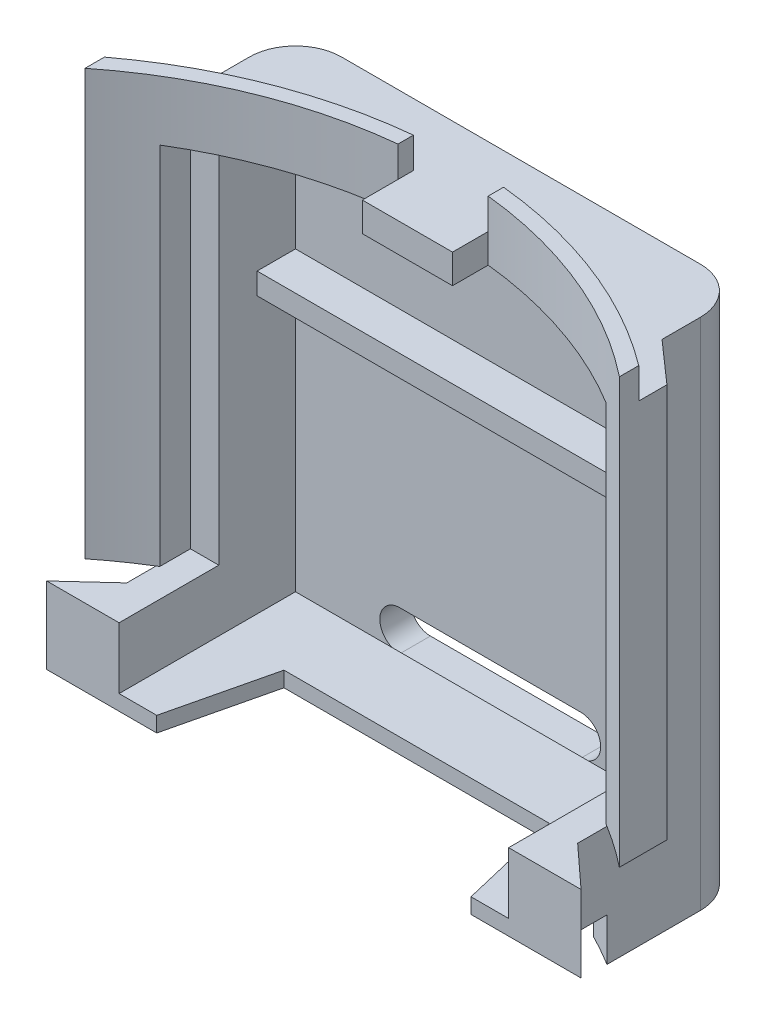
from build123d import *

# Parameters (mm, degrees)
EXTRUDE_1_DEPTH     = 17.75
CUT_EXTRUDE_1_DEPTH = 1
SKETCH_3_W          = 2.94
SKETCH_3_H          = 1
CUT_EXTRUDE_2_DEPTH = 21.522587556
CUT_EXTRUDE_3_DEPTH = 3.9
SKETCH_5_W          = 12.7
SKETCH_5_H          = 2.983573368
CUT_EXTRUDE_4_DEPTH = 1.4
SKETCH_6_W          = 12.7
SKETCH_6_H          = 2.983573368
CUT_EXTRUDE_5_DEPTH = 13.9
SKETCH_7_W          = 14.55
SKETCH_7_H          = 11.9
CUT_EXTRUDE_6_DEPTH = 21.079257954
EXTRUDE_2_DEPTH     = 0.5
EXTRUDE_3_DEPTH     = 0.5
EXTRUDE_4_DEPTH     = 2
CUT_EXTRUDE_7_DEPTH = 1
SKETCH_12_W         = 12.7
SKETCH_12_H         = 0.7
EXTRUDE_5_DEPTH     = 1.25
FILLET_1_R          = 1.5
EXTRUDE_START       = -0.95
EXTRUDE_6_DEPTH     = 0.95


with BuildPart() as part:
    # Эскиз1 → Бобышка-Вытянуть1 (new body)
    with BuildSketch(Plane(origin=(0, 0, 0), x_dir=(1, 0, 0), z_dir=(0, 1, 0))):
        with BuildLine():
            Line((-7.35, 2.75), (-7.35, 5.5))
            Line((-7.35, 5.5), (7.35, 5.5))
            Line((7.35, 5.5), (7.35, 2.75))
            Line((7.35, 2.75), (8.71, 1.55))
            Line((8.71, 1.55), (8.71, 0))
            ThreePointArc((8.71, 0), (0, 3.039347647), (-8.71, 0))
            Line((-8.71, 0), (-8.71, 1.55))
            Line((-8.71, 1.55), (-7.35, 2.75))
        make_face()
    extrude(amount=EXTRUDE_1_DEPTH)

    # Эскиз2 → Вырез-Вытянуть1 (cut)
    with BuildSketch(Plane(origin=(0, 17.75, 0), x_dir=(1, 0, 0), z_dir=(0, 1, 0))):
        with BuildLine():
            Line((8.71, 0.631840908), (8.71, 1.55))
            Line((8.71, 1.55), (7.35, 2.75))
            Line((7.35, 2.75), (7.35, 5.5))
            Line((7.35, 5.5), (-7.35, 5.5))
            Line((-7.35, 5.5), (-7.35, 2.75))
            Line((-7.35, 2.75), (-8.71, 1.55))
            Line((-8.71, 1.55), (-8.71, 0.631840908))
            ThreePointArc((-8.71, 0.631840908), (0, 3.539347647), (8.71, 0.631840908))
        make_face()
    extrude(amount=-CUT_EXTRUDE_1_DEPTH, mode=Mode.SUBTRACT)

    # Эскиз3 → Вырез-Вытянуть2 (cut, through all)
    with BuildSketch(Plane(origin=(0, 0, -5.5), x_dir=(-1, 0, 0), z_dir=(0, 0, -1))):
        with Locations((0, 17.25)):
            Rectangle(SKETCH_3_W, SKETCH_3_H)
    extrude(amount=-CUT_EXTRUDE_2_DEPTH, mode=Mode.SUBTRACT)

    # Эскиз4 → Вырез-Вытянуть3 (cut)
    with BuildSketch(Plane.XZ):
        with BuildLine():
            Line((-7.35, -2.75), (-7.35, -0.954778819))
            ThreePointArc((-7.35, -0.954778819), (-8.044178059, -0.497584831), (-8.71, 0))
            Line((-8.71, 0), (-8.71, -1.55))
            Line((-8.71, -1.55), (-7.35, -2.75))
        make_face()
        with BuildLine():
            Line((7.35, -2.75), (7.35, -0.954778819))
            ThreePointArc((7.35, -0.954778819), (8.044178059, -0.497584831), (8.71, 0))
            Line((8.71, 0), (8.71, -1.55))
            Line((8.71, -1.55), (7.35, -2.75))
        make_face()
    extrude(amount=-CUT_EXTRUDE_3_DEPTH, mode=Mode.SUBTRACT)

    # Эскиз5 → Вырез-Вытянуть4 (cut)
    with BuildSketch(Plane.XZ):
        with Locations((0, -3.008213316)):
            Rectangle(SKETCH_5_W, SKETCH_5_H)
    extrude(amount=-CUT_EXTRUDE_4_DEPTH, mode=Mode.SUBTRACT)

    # Эскиз6 → Вырез-Вытянуть5 (cut)
    with BuildSketch(Plane(origin=(0, 1.9, 0), x_dir=(-1, 0, 0), z_dir=(0, -1, 0))):
        with Locations((0, 3.008213316)):
            Rectangle(SKETCH_6_W, SKETCH_6_H)
    extrude(amount=-CUT_EXTRUDE_5_DEPTH, mode=Mode.SUBTRACT)

    # Эскиз7 → Вырез-Вытянуть6 (cut, through all)
    with BuildSketch(Plane(origin=(0, 0, -2), x_dir=(-1, 0, 0), z_dir=(0, 0, -1))):
        with Locations((0, 9.85)):
            Rectangle(SKETCH_7_W, SKETCH_7_H)
    extrude(amount=-CUT_EXTRUDE_6_DEPTH, mode=Mode.SUBTRACT)

    # Эскиз8 → Бобышка-Вытянуть2 (add)
    with BuildSketch(Plane.XZ.offset(-1.4)):
        with BuildLine():
            Line((-7.35, 0), (-4.825, 0))
            Line((-4.825, 0), (-4.325, -2.1))
            Line((-4.325, -2.1), (4.325, -2.1))
            Line((4.325, -2.1), (4.825, 0))
            Line((4.825, 0), (7.35, 0))
            Line((7.35, 0), (7.35, -0.954778819))
            ThreePointArc((7.35, -0.954778819), (0, -3.039347647), (-7.35, -0.954778819))
            Line((-7.35, -0.954778819), (-7.35, 0))
        make_face()
    extrude(amount=-EXTRUDE_2_DEPTH)

    # Эскиз9 → Бобышка-Вытянуть3 (add)
    with BuildSketch(Plane.XZ.offset(-1.4)):
        Polygon((-4.825, 0), (-5.122619048, 1.25), (-8.71, 1.25), (-7.35, 0), align=None)
        Polygon((4.825, 0), (5.122619048, 1.25), (8.71, 1.25), (7.35, 0), align=None)
    extrude(amount=-EXTRUDE_3_DEPTH)

    # Эскиз10 → Бобышка-Вытянуть4 (add)
    with BuildSketch(Plane(origin=(0, 1.9, 0), x_dir=(1, 0, 0), z_dir=(0, 1, 0))):
        with BuildLine():
            Line((-7.35, 0), (-8.71, -1.25))
            Line((-8.71, -1.25), (-6.35, -1.25))
            Line((-6.35, -1.25), (-6.35, 1.516426632))
            ThreePointArc((-6.35, 1.516426632), (-6.855753939, 1.24584747), (-7.35, 0.954778819))
            Line((-7.35, 0.954778819), (-7.35, 0))
        make_face()
        with BuildLine():
            Line((7.35, 0), (7.35, 0.954778819))
            ThreePointArc((7.35, 0.954778819), (6.855753939, 1.24584747), (6.35, 1.516426632))
            Line((6.35, 1.516426632), (6.35, -1.25))
            Line((6.35, -1.25), (8.71, -1.25))
            Line((8.71, -1.25), (7.35, 0))
        make_face()
    extrude(amount=EXTRUDE_4_DEPTH)

    # Эскиз11 → Вырез-Вытянуть7 (cut)
    with BuildSketch(Plane(origin=(0, 0, -5.5), x_dir=(-1, 0, 0), z_dir=(0, 0, -1))):
        with BuildLine():
            Line((-2.95, 3.15), (2.95, 3.15))
            ThreePointArc((2.95, 3.15), (3.6, 2.5), (2.95, 1.85))
            Line((2.95, 1.85), (-2.95, 1.85))
            ThreePointArc((-2.95, 1.85), (-3.6, 2.5), (-2.95, 3.15))
        make_face()
    extrude(amount=-CUT_EXTRUDE_7_DEPTH, mode=Mode.SUBTRACT)

    # Эскиз12 → Бобышка-Вытянуть5 (add)
    with BuildSketch(Plane.XY.offset(-4.5)):
        with Locations((0, 11.23)):
            Rectangle(SKETCH_12_W, SKETCH_12_H)
    extrude(amount=EXTRUDE_5_DEPTH)

    # Скругление1
    fillet_1_edges = [part.edges().sort_by_distance(p)[0] for p in [
        (-7.35, 8.375, -5.5),
        (7.35, 8.375, -5.5),
    ]]
    fillet(fillet_1_edges, radius=FILLET_1_R)

    # Эскиз13 → Бобышка-Вытянуть6 (add)
    with BuildSketch(Plane(origin=(0, 16.75, 0), x_dir=(1, 0, 0), z_dir=(0, 1, 0)).offset(EXTRUDE_START)):
        with BuildLine():
            Line((-1.47, 2.961958753), (-1.47, 1.8))
            Line((-1.47, 1.8), (1.47, 1.8))
            Line((1.47, 1.8), (1.47, 2.961958753))
            ThreePointArc((1.47, 2.961958753), (0, 3.039347647), (-1.47, 2.961958753))
        make_face()
    extrude(amount=EXTRUDE_6_DEPTH)


solid = part.part
